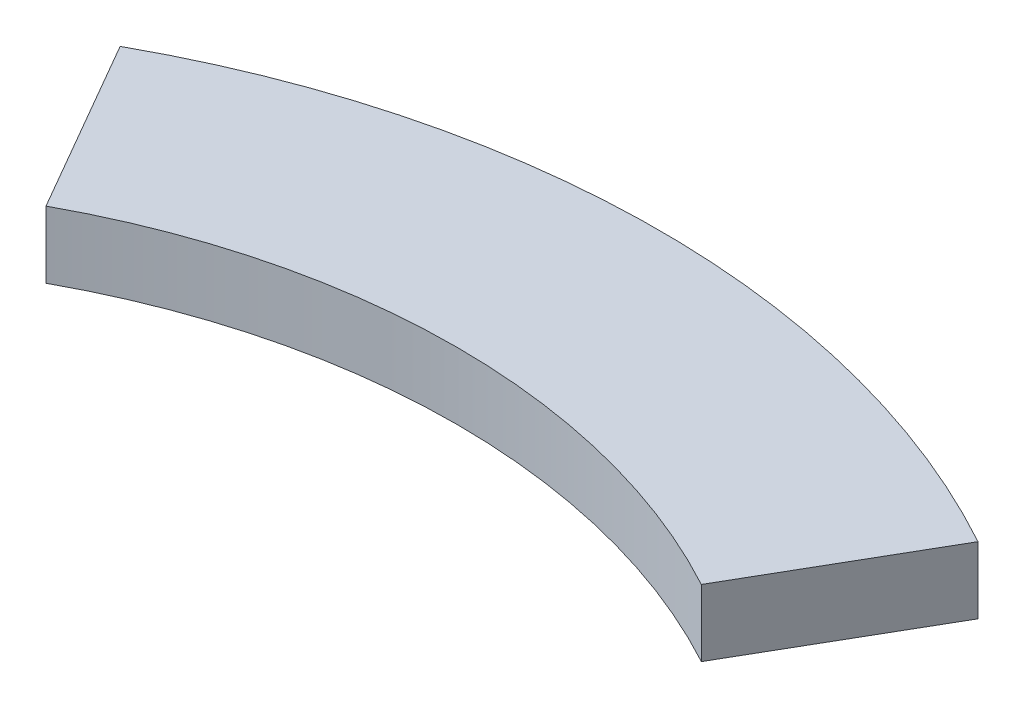
from build123d import *

# Parameters (mm, degrees)
BOSS_EXTRUDE1_DEPTH = 2.8
SKETCH2_R           = 1.625
CUT_EXTRUDE1_DEPTH  = 2


with BuildPart() as part:
    # Sketch1 → Boss-Extrude1 (new body)
    with BuildSketch(Plane(origin=(0, 0, 0), x_dir=(1, 0, 0), z_dir=(0, 1, 0))):
        with BuildLine():
            Line((-17.971705397, 32.627906846), (-13.729256498, 25.279769804))
            ThreePointArc((-13.729256498, 25.279769804), (0, 28.767329478), (13.729256498, 25.279769804))
            Line((13.729256498, 25.279769804), (17.971705397, 32.627906846))
            ThreePointArc((17.971705397, 32.627906846), (0, 37.25), (-17.971705397, 32.627906846))
        make_face()
    extrude(amount=BOSS_EXTRUDE1_DEPTH)

    # Sketch2 → Cut-Extrude1 (cut)
    with BuildSketch(Plane.XZ):
        with Locations(Location((0, -33.008664739, 0), (0, 0, 270))):
            Circle(SKETCH2_R)
    extrude(amount=-CUT_EXTRUDE1_DEPTH, mode=Mode.SUBTRACT)


solid = part.part
